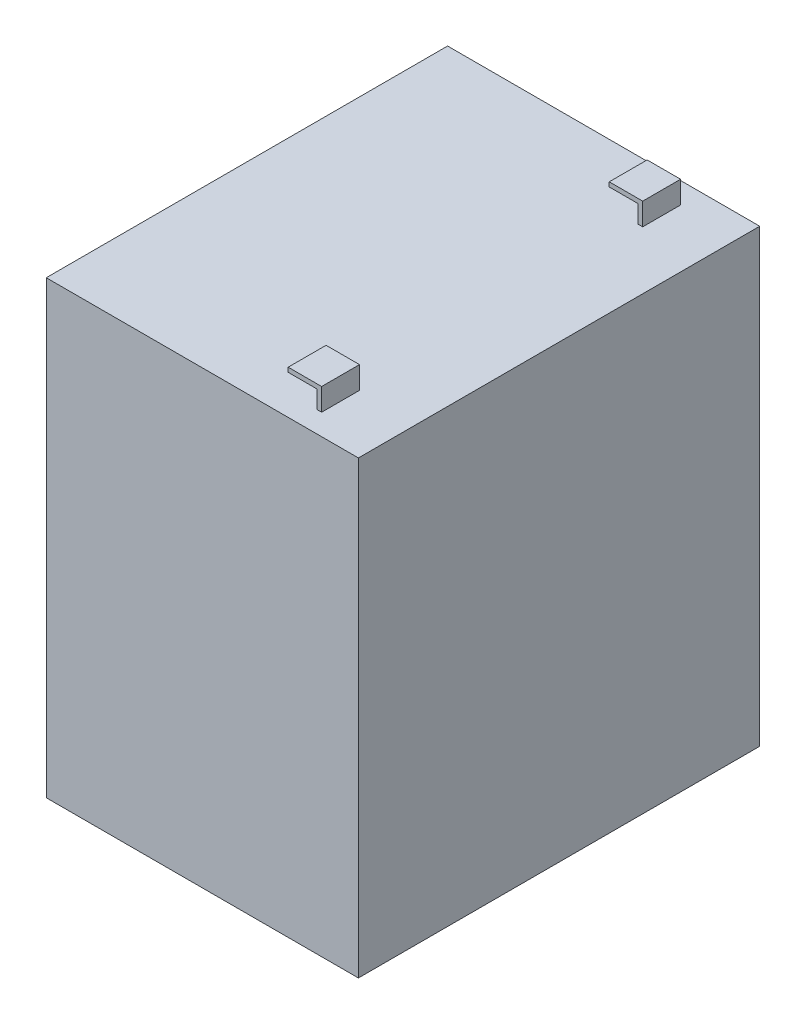
from build123d import *

# Parameters (mm, degrees)
SKETCH_2_W          = 70
SKETCH_2_H          = 90
EXTRUDE_1_DEPTH     = 101
SKETCH_3_W          = 7.5
SKETCH_3_H          = 8.5
EXTRUDE_1_2_DEPTH   = 5
SKETCH_4_W          = 6.5
SKETCH_4_H          = 4
CUT_EXTRUDE_1_DEPTH = 141.458401315


with BuildPart() as part:
    # 草图2 → Extrude 1 (new body)
    with BuildSketch(Plane(origin=(0, 0, 0), x_dir=(1, 0, 0), z_dir=(0, 1, 0))):
        Rectangle(SKETCH_2_W, SKETCH_2_H)
    extrude(amount=EXTRUDE_1_DEPTH)

    # 草图3 → Extrude 1 2 (add)
    with BuildSketch(Plane(origin=(0, 101, 0), x_dir=(1, 0, 0), z_dir=(0, 1, 0))):
        with Locations((18.25, 36)):
            Rectangle(SKETCH_3_W, SKETCH_3_H)
        with Locations((18.25, -36)):
            Rectangle(SKETCH_3_W, SKETCH_3_H)
    extrude(amount=EXTRUDE_1_2_DEPTH)

    # 草图4 → 切除-拉伸1 (cut, through all)
    with BuildSketch(Plane.XY.offset(40.25)):
        with Locations((17.75, 103)):
            Rectangle(SKETCH_4_W, SKETCH_4_H)
    extrude(amount=-CUT_EXTRUDE_1_DEPTH, mode=Mode.SUBTRACT)


solid = part.part
